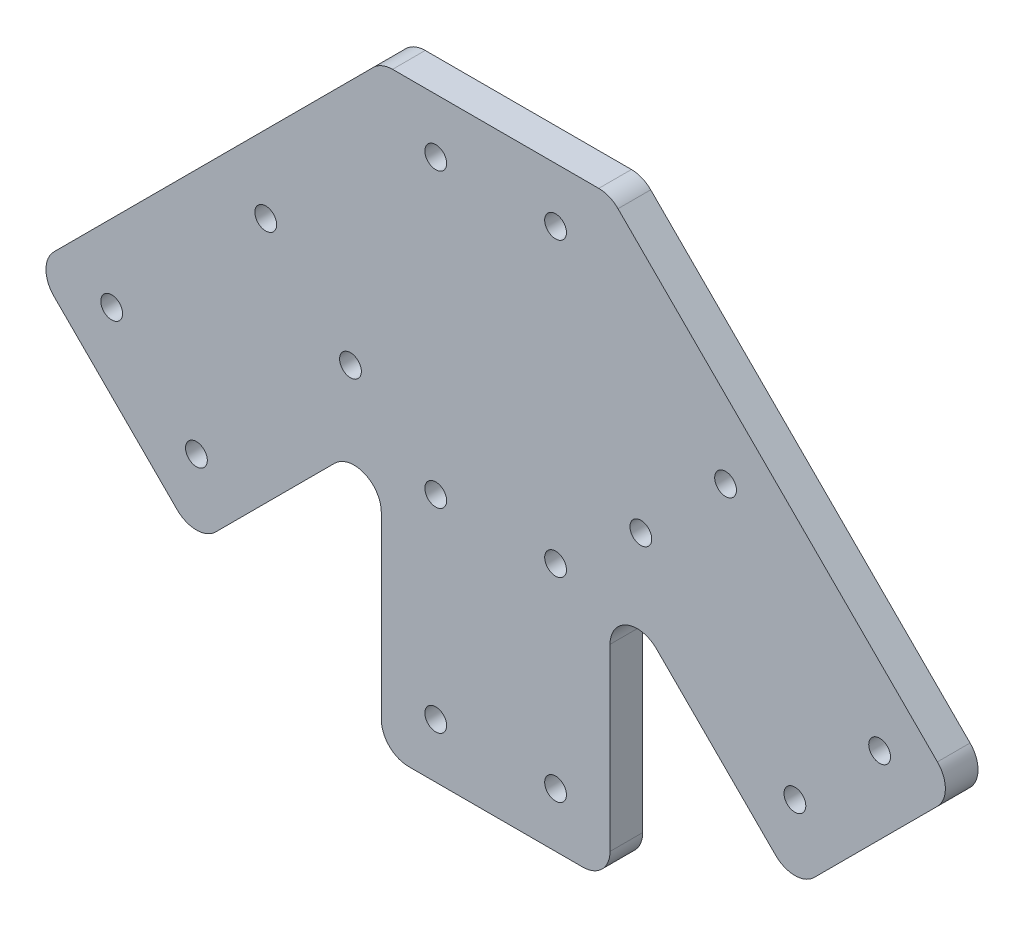
from build123d import *

# Parameters (mm, degrees)
SKETCH_1_R      = 2
EXTRUDE_1_DEPTH = 6


with BuildPart() as part:
    # Эскиз1 → Бобышка-Вытянуть1 (new body)
    with BuildSketch(Plane.XY):
        with BuildLine():
            Line((-16, -50), (16, -50))
            ThreePointArc((16, -50), (19.535533906, -48.535533906), (21, -45))
            Line((21, -45), (21, -12.071067812))
            ThreePointArc((21, -12.071067812), (24.086582838, -7.451670149), (29.535533906, -8.535533906))
            Line((29.535533906, -8.535533906), (51.405591591, -30.405591591))
            ThreePointArc((51.405591591, -30.405591591), (54.941125497, -31.870057685), (58.476659403, -30.405591591))
            Line((58.476659403, -30.405591591), (81.104076401, -7.778174593))
            ThreePointArc((81.104076401, -7.778174593), (82.568542495, -4.242640687), (81.104076401, -0.707106781))
            Line((81.104076401, -0.707106781), (22.464466094, 57.932503526))
            ThreePointArc((22.464466094, 57.932503526), (20.84234935, 59.016367282), (18.928932188, 59.39696962))
            Line((18.928932188, 59.39696962), (-18.928932188, 59.39696962))
            ThreePointArc((-18.928932188, 59.39696962), (-20.84234935, 59.016367282), (-22.464466094, 57.932503526))
            Line((-22.464466094, 57.932503526), (-81.104076401, -0.707106781))
            ThreePointArc((-81.104076401, -0.707106781), (-82.568542495, -4.242640687), (-81.104076401, -7.778174593))
            Line((-81.104076401, -7.778174593), (-58.476659403, -30.405591591))
            ThreePointArc((-58.476659403, -30.405591591), (-54.941125497, -31.870057685), (-51.405591591, -30.405591591))
            Line((-51.405591591, -30.405591591), (-29.535533906, -8.535533906))
            ThreePointArc((-29.535533906, -8.535533906), (-24.086582838, -7.451670149), (-21, -12.071067812))
            Line((-21, -12.071067812), (-21, -45))
            ThreePointArc((-21, -45), (-19.535533906, -48.535533906), (-16, -50))
        make_face()
        with Locations((-70.497474683, -4.242640687)):
            Circle(SKETCH_1_R, mode=Mode.SUBTRACT)
        with Locations((-54.941125497, -19.798989873)):
            Circle(SKETCH_1_R, mode=Mode.SUBTRACT)
        with Locations((-42.213203436, 24.04163056)):
            Circle(SKETCH_1_R, mode=Mode.SUBTRACT)
        with Locations((-26.656854249, 8.485281374)):
            Circle(SKETCH_1_R, mode=Mode.SUBTRACT)
        with Locations((-11, -40)):
            Circle(SKETCH_1_R, mode=Mode.SUBTRACT)
        with Locations((-11, 49.39696962)):
            Circle(SKETCH_1_R, mode=Mode.SUBTRACT)
        with Locations((-11, -4.242640687)):
            Circle(SKETCH_1_R, mode=Mode.SUBTRACT)
        with Locations(Location((11, -40, 0), (0, 0, 180))):
            Circle(SKETCH_1_R, mode=Mode.SUBTRACT)
        with Locations(Location((11, -4.242640687, 0), (0, 0, 180))):
            Circle(SKETCH_1_R, mode=Mode.SUBTRACT)
        with Locations(Location((26.656854249, 8.485281374, 0), (0, 0, 180))):
            Circle(SKETCH_1_R, mode=Mode.SUBTRACT)
        with Locations(Location((54.941125497, -19.798989873, 0), (0, 0, 180))):
            Circle(SKETCH_1_R, mode=Mode.SUBTRACT)
        with Locations(Location((70.497474683, -4.242640687, 0), (0, 0, 180))):
            Circle(SKETCH_1_R, mode=Mode.SUBTRACT)
        with Locations(Location((42.213203436, 24.04163056, 0), (0, 0, 180))):
            Circle(SKETCH_1_R, mode=Mode.SUBTRACT)
        with Locations(Location((11, 49.39696962, 0), (0, 0, 180))):
            Circle(SKETCH_1_R, mode=Mode.SUBTRACT)
    extrude(amount=EXTRUDE_1_DEPTH)


solid = part.part
